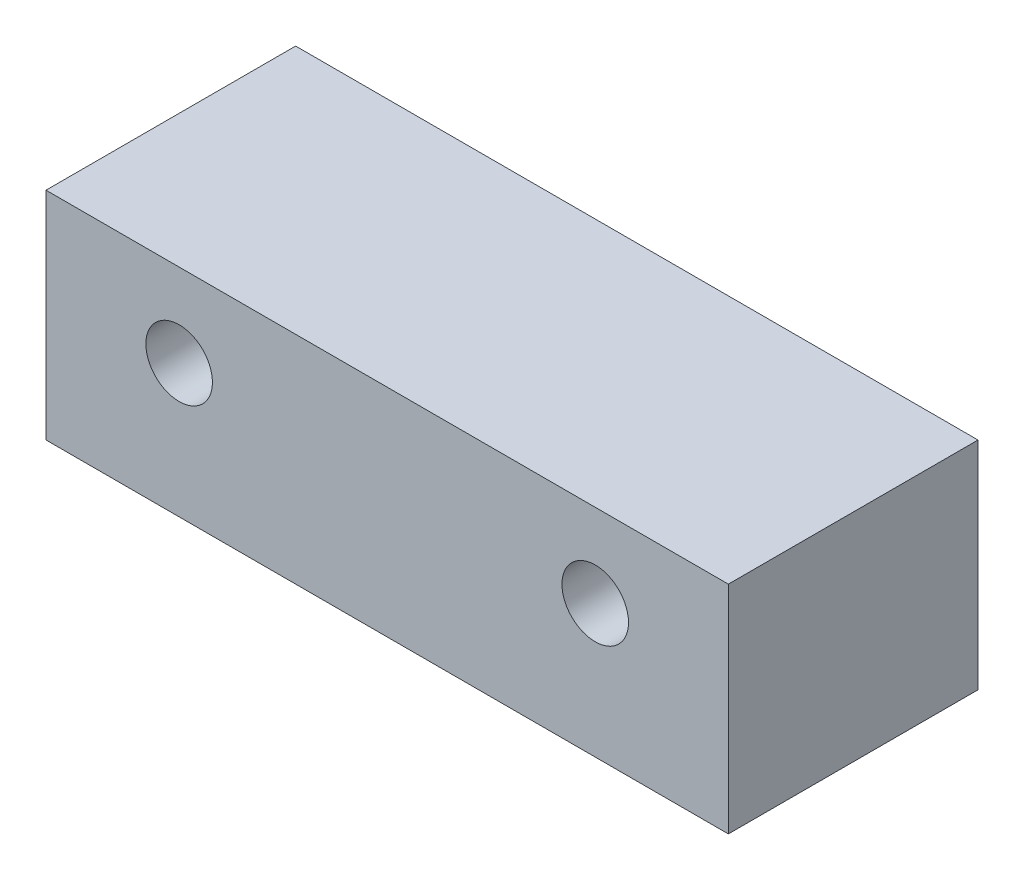
from build123d import *

# Parameters (mm, degrees)
SKETCH_1_W      = 41
SKETCH_1_H      = 10
SKETCH_1_R      = 2
EXTRUDE_1_DEPTH = 15
SKETCH_2_W      = 41
SKETCH_2_H      = 3
EXTRUDE_2_DEPTH = 15


with BuildPart() as part:
    # 草图1 → 凸台-拉伸1 (new body)
    with BuildSketch(Plane.XY):
        Rectangle(SKETCH_1_W, SKETCH_1_H)
        with Locations((12.5, 0)):
            Circle(SKETCH_1_R, mode=Mode.SUBTRACT)
        with Locations(Location((-12.5, 0, 0), (0, 0, 180))):
            Circle(SKETCH_1_R, mode=Mode.SUBTRACT)
    extrude(amount=EXTRUDE_1_DEPTH)

    # 草图2 → 凸台-拉伸2 (add)
    with BuildSketch(Plane.XY.offset(15)):
        with Locations((0, -6.5)):
            Rectangle(SKETCH_2_W, SKETCH_2_H)
    extrude(amount=-EXTRUDE_2_DEPTH)


solid = part.part
